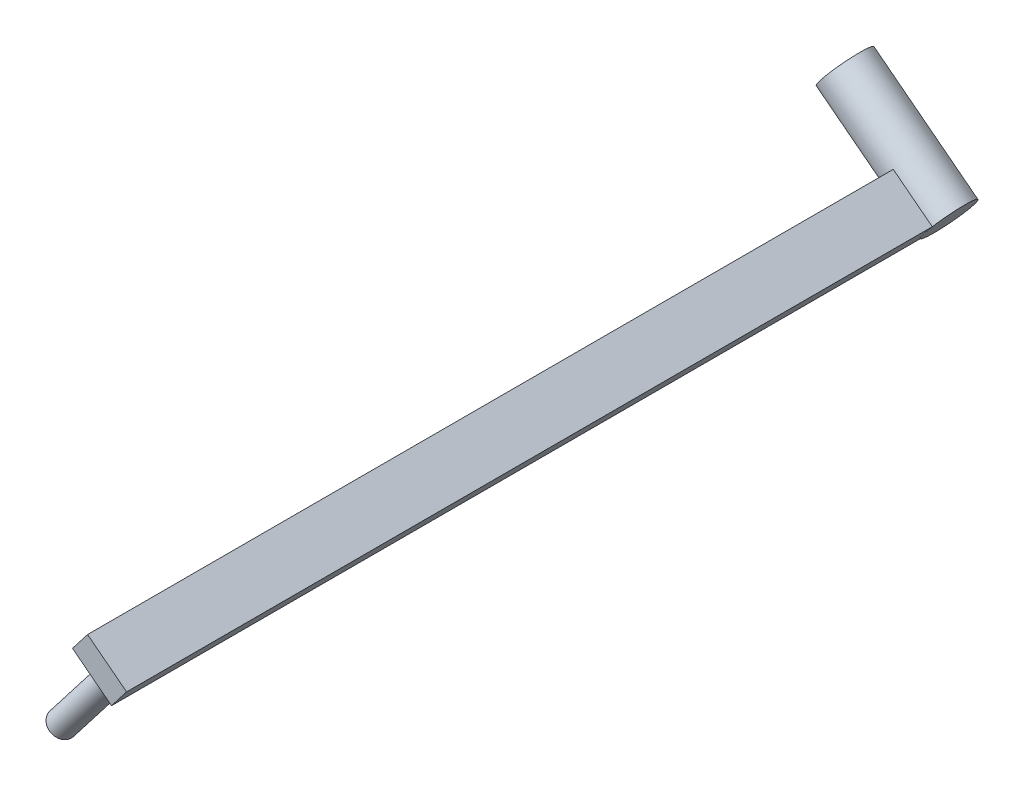
from build123d import *

# Parameters (mm, degrees)
BOSS_EXTRUDE1_DEPTH = 5
BOSS_EXTRUDE2_START = 3
SKETCH1_3_R         = 1.5
BOSS_EXTRUDE2_DEPTH = 3
SKETCH2_R           = 0.75
BOSS_EXTRUDE3_DEPTH = 5


with BuildPart() as part:
    # Sketch1 → Boss-Extrude1 (new body)
    with BuildSketch(Plane(origin=(-196.842346713, 152.137054389, 0), x_dir=(0, 0, -1), z_dir=(0.7912235329674926, -0.6115270401858278, 0))):
        with BuildLine():
            ThreePointArc((196.313865969, 21.1), (197.988007446, 20.578495388), (199.012913027, 22.001269191))
            ThreePointArc((199.012913027, 22.001269191), (197.037818608, 23.424042993), (196.313865969, 21.1))
        make_face()
    extrude(amount=-BOSS_EXTRUDE1_DEPTH)

    # Sketch1<3> → Boss-Extrude2 (add)
    with BuildSketch(Plane(origin=(-196.842346713, 152.137054389, 0), x_dir=(0, 0, -1), z_dir=(0.7912235329674926, -0.6115270401858278, 0)).offset(BOSS_EXTRUDE2_START)):
        with BuildLine():
            ThreePointArc((196.297042618, 21.1), (196.00952923, 21.826729329), (196.122895609, 22.6))
            Line((196.122895609, 22.6), (147.122895609, 22.6))
            Line((147.122895609, 22.6), (147.122895609, 21.1))
            Line((147.122895609, 21.1), (196.297042618, 21.1))
        make_face()
        with Locations((197.512913027, 22.001269191)):
            Circle(SKETCH1_3_R)
    extrude(amount=-BOSS_EXTRUDE2_DEPTH)


with BuildPart() as boss_extrude2_piece_1:
    # of the separate pieces the step leaves, piece 1, a body of its own (boss_extrude2_pieces)
    add(part.part.solids().sort_by_distance((-181.565455567, 166.997289814, -147.122895609))[0])

    # Sketch2 → Boss-Extrude3 (add)
    with BuildSketch(Plane(origin=(12.903220548, 16.694816546, 0), x_dir=(0.7912235329674926, -0.6115270401858278, 0), z_dir=(-0.6115270401858278, -0.7912235329674926, 0))):
        with Locations((-246.824960676, -147.977498822)):
            Circle(SKETCH2_R)
    extrude(amount=BOSS_EXTRUDE3_DEPTH)


with BuildPart() as boss_extrude2_piece_2:
    # of the separate pieces the step leaves, piece 2, a body of its own (boss_extrude2_pieces)
    add(part.part.solids().sort_by_distance((-187.89524383, 171.889506136, -196.313865969))[0])


solid = Compound([boss_extrude2_piece_1.part, boss_extrude2_piece_2.part])
